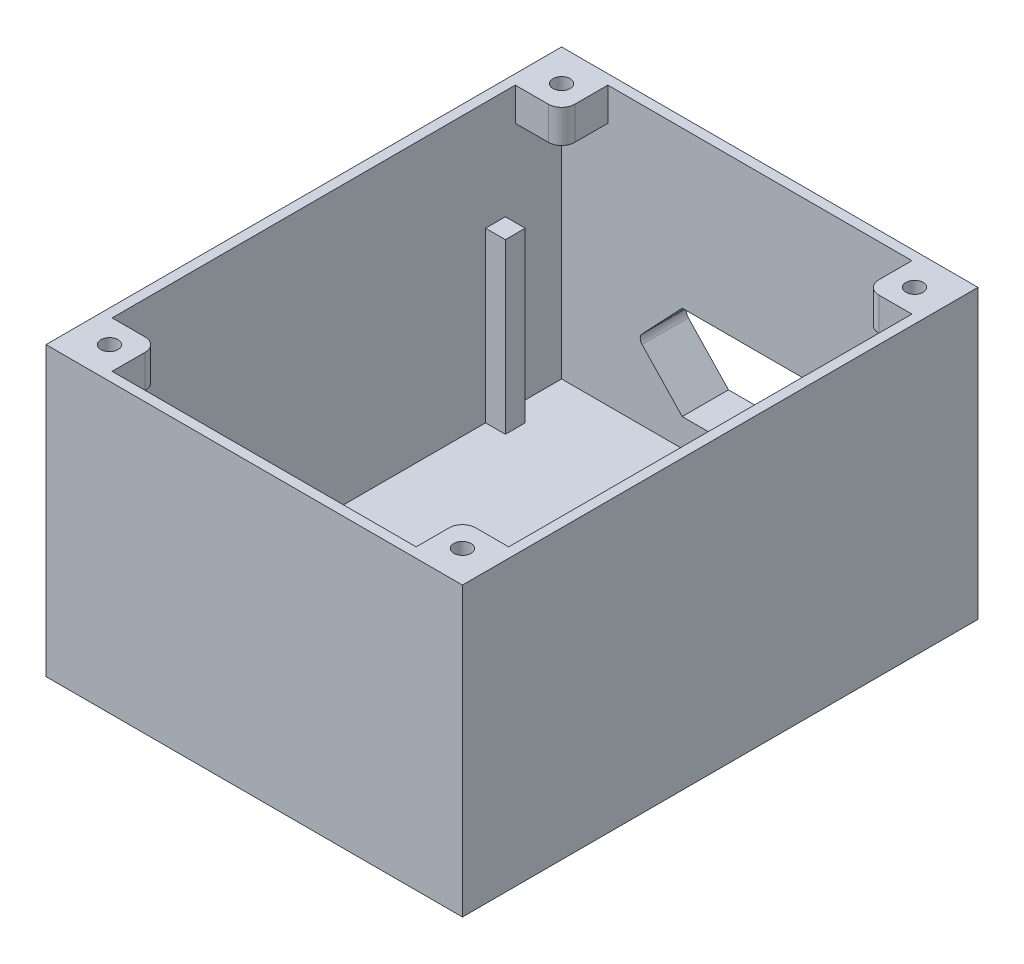
from build123d import *

# Parameters (mm, degrees)
ESBO_O1_W                 = 63
ESBO_O1_H                 = 45
ESBO_O1_W_2               = 60
ESBO_O1_H_2               = 42
RESSALTO_EXTRUS_O2_DEPTH  = 1.5
RESSALTO_EXTRUS_O3_START  = 1.5
ESBO_O1_3_W               = 63
ESBO_O1_3_H               = 45
ESBO_O1_3_W_2             = 60
ESBO_O1_3_H_2             = 42
RESSALTO_EXTRUS_O3_DEPTH  = 75
RESSALTO_EXTRUS_O4_DEPTH  = 15
CORTE_EXTRUS_O1_DEPTH     = 27
ESBO_O4_W                 = 63
ESBO_O4_H                 = 45
RESSALTO_EXTRUS_O6_DEPTH  = 1.5
ESBO_O5_W                 = 63
ESBO_O5_H                 = 1.5
CORTE_EXTRUS_O2_DEPTH     = 109.436617432
RESSALTO_EXTRUS_O7_START  = 42
ESBO_O6_R                 = 1.3
RESSALTO_EXTRUS_O7_DEPTH  = 5
ESPELHAR2_START           = 42
ESPELHAR2_COPY_1_SKETCH_R = 1.3
ESPELHAR2_COPY_1_DEPTH    = 5
RESSALTO_EXTRUS_O8_START  = -5.5
RESSALTO_EXTRUS_O8_DEPTH  = 5.5
ESBO_O7_W                 = 3
ESBO_O7_H                 = 3
RESSALTO_EXTRUS_O9_DEPTH  = 25.5


with BuildPart() as part:
    # Esboço1 → Ressalto-extrusão2 (new body)
    # profile 1 of 3: a face of its own
    with BuildSketch(Plane.XY):
        with Locations((30, 21)):
            Rectangle(ESBO_O1_W, ESBO_O1_H)
        with Locations((30, 21)):
            Rectangle(ESBO_O1_W_2, ESBO_O1_H_2, mode=Mode.SUBTRACT)
    # profile 2 of 3: a face of its own
    with BuildSketch(Plane.XY):
        with Locations((30, 21)):
            Rectangle(ESBO_O1_W_2, ESBO_O1_H_2)
        with BuildLine():
            ThreePointArc((12.174114264, 11.987815308), (11.9, 11.3), (12.174114264, 10.612184692))
            Line((12.174114264, 10.612184692), (18.25, 4.2))
            Line((18.25, 4.2), (41.75, 4.2))
            Line((41.75, 4.2), (47.825885736, 10.612184692))
            ThreePointArc((47.825885736, 10.612184692), (48.1, 11.3), (47.825885736, 11.987815308))
            Line((47.825885736, 11.987815308), (41.75, 18.4))
            Line((41.75, 18.4), (18.25, 18.4))
            Line((18.25, 18.4), (12.174114264, 11.987815308))
        make_face(mode=Mode.SUBTRACT)
    # profile 3 of 3: a face of its own
    with BuildSketch(Plane.XY):
        with Locations((30, 21)):
            Rectangle(ESBO_O1_W_2, ESBO_O1_H_2)
        with BuildLine():
            ThreePointArc((10.722342792, 13.363445925), (9.9, 11.3), (10.722342792, 9.236554075))
            Line((10.722342792, 9.236554075), (17.389851698, 2.2))
            Line((17.389851698, 2.2), (42.610148302, 2.2))
            Line((42.610148302, 2.2), (49.277657208, 9.236554075))
            ThreePointArc((49.277657208, 9.236554075), (50.1, 11.3), (49.277657208, 13.363445925))
            Line((49.277657208, 13.363445925), (42.610148302, 20.4))
            Line((42.610148302, 20.4), (17.389851698, 20.4))
            Line((17.389851698, 20.4), (10.722342792, 13.363445925))
        make_face(mode=Mode.SUBTRACT)
    extrude(amount=RESSALTO_EXTRUS_O2_DEPTH)

    # Esboço1<3> → Ressalto-extrusão3 (add)
    with BuildSketch(Plane.XY.offset(RESSALTO_EXTRUS_O3_START)):
        with Locations((30, 21)):
            Rectangle(ESBO_O1_3_W, ESBO_O1_3_H)
        with Locations((30, 21)):
            Rectangle(ESBO_O1_3_W_2, ESBO_O1_3_H_2, mode=Mode.SUBTRACT)
    extrude(amount=RESSALTO_EXTRUS_O3_DEPTH)

    # Esboço2 → Ressalto-extrusão4 (add)
    with BuildSketch(Plane(origin=(0, 0, 0), x_dir=(1, 0, 0), z_dir=(0, 1, 0))):
        with BuildLine():
            Line((18.25, -54.8), (41.75, -54.8))
            Line((41.75, -54.8), (48.66440786, -62.248218844))
            ThreePointArc((48.66440786, -62.248218844), (49.654140055, -63.822712297), (50, -65.65))
            Line((50, -65.65), (51.5, -65.65))
            ThreePointArc((51.5, -65.65), (51.050382071, -63.274525986), (49.763730218, -61.227684497))
            Line((49.763730218, -61.227684497), (42.404219824, -53.3))
            Line((42.404219824, -53.3), (17.595780176, -53.3))
            Line((17.595780176, -53.3), (10.236269782, -61.227684497))
            ThreePointArc((10.236269782, -61.227684497), (8.949617929, -63.274525986), (8.5, -65.65))
            Line((8.5, -65.65), (10, -65.65))
            ThreePointArc((10, -65.65), (10.345859945, -63.822712297), (11.33559214, -62.248218844))
            Line((11.33559214, -62.248218844), (18.25, -54.8))
        make_face()
        with BuildLine():
            ThreePointArc((11.33559214, -69.051781156), (10.345859945, -67.477287703), (10, -65.65))
            Line((10, -65.65), (8.5, -65.65))
            ThreePointArc((8.5, -65.65), (8.949617929, -68.025474014), (10.236269782, -70.072315503))
            Line((10.236269782, -70.072315503), (16.2032846, -76.5))
            Line((16.2032846, -76.5), (18.25, -76.5))
            Line((18.25, -76.5), (11.33559214, -69.051781156))
        make_face()
        with BuildLine():
            Line((51.5, -65.65), (50, -65.65))
            ThreePointArc((50, -65.65), (49.654140055, -67.477287703), (48.66440786, -69.051781156))
            Line((48.66440786, -69.051781156), (41.75, -76.5))
            Line((41.75, -76.5), (43.7967154, -76.5))
            Line((43.7967154, -76.5), (49.763730218, -70.072315503))
            ThreePointArc((49.763730218, -70.072315503), (51.050382071, -68.025474014), (51.5, -65.65))
        make_face()
    extrude(amount=RESSALTO_EXTRUS_O4_DEPTH)

    # Esboço2<3> → Corte-extrusão1 (cut)
    with BuildSketch(Plane(origin=(0, 0, 0), x_dir=(1, 0, 0), z_dir=(0, 1, 0))):
        with BuildLine():
            Line((41.095780176, -56.3), (30, -56.3))
            Line((30, -56.3), (30, -75))
            Line((30, -75), (41.095780176, -75))
            Line((41.095780176, -75), (47.565085502, -68.031246809))
            ThreePointArc((47.565085502, -68.031246809), (48.5, -65.65), (47.565085502, -63.268753191))
            Line((47.565085502, -63.268753191), (41.095780176, -56.3))
        make_face()
        with BuildLine():
            Line((30, -75), (30, -56.3))
            Line((30, -56.3), (18.904219824, -56.3))
            Line((18.904219824, -56.3), (12.434914498, -63.268753191))
            ThreePointArc((12.434914498, -63.268753191), (11.5, -65.65), (12.434914498, -68.031246809))
            Line((12.434914498, -68.031246809), (18.904219824, -75))
            Line((18.904219824, -75), (30, -75))
        make_face()
    extrude(amount=-CORTE_EXTRUS_O1_DEPTH, mode=Mode.SUBTRACT)

    # Esboço4 → Ressalto-extrusão6 (add)
    with BuildSketch(Plane.XY.offset(76.5)):
        with Locations((30, 21)):
            Rectangle(ESBO_O4_W, ESBO_O4_H)
    extrude(amount=RESSALTO_EXTRUS_O6_DEPTH)

    # Esboço5 → Corte-extrusão2 (cut, through all)
    with BuildSketch(Plane.XY.offset(78)):
        with Locations((30, 42.75)):
            Rectangle(ESBO_O5_W, ESBO_O5_H)
    extrude(amount=-CORTE_EXTRUS_O2_DEPTH, mode=Mode.SUBTRACT)

    # Esboço6 → Ressalto-extrusão7 (add)
    with BuildSketch(Plane(origin=(0, 0, 0), x_dir=(1, 0, 0), z_dir=(0, 1, 0)).offset(RESSALTO_EXTRUS_O7_START)):
        with BuildLine():
            Line((60, -1.5), (60, -8.5))
            Line((60, -8.5), (55, -8.5))
            ThreePointArc((55, -8.5), (53.585786438, -7.914213562), (53, -6.5))
            Line((53, -6.5), (53, -1.5))
            Line((53, -1.5), (60, -1.5))
        make_face()
        with Locations(Location((56.7, -4.8, 0), (0, 0, 90))):
            Circle(ESBO_O6_R, mode=Mode.SUBTRACT)
    ressalto_extrus_o7 = extrude(amount=-RESSALTO_EXTRUS_O7_DEPTH)

    # Espelhar1: Ressalto-extrusão7 across plane
    add(ressalto_extrus_o7.mirror(Plane.XY.offset(39)))

    # Espelhar2: Ressalto-extrusão7 across plane
    add(ressalto_extrus_o7.mirror(Plane.ZY.offset(-30)))

    # Espelhar2 copy 1 sketch → Espelhar2 copy 1 (add)
    with BuildSketch(Plane(origin=(60, 0, 78), x_dir=(-1, 0, 0), z_dir=(0, 1, 0)).offset(ESPELHAR2_START)):
        with BuildLine():
            Line((60, -1.5), (60, -8.5))
            Line((60, -8.5), (55, -8.5))
            ThreePointArc((55, -8.5), (53.585786438, -7.914213562), (53, -6.5))
            Line((53, -6.5), (53, -1.5))
            Line((53, -1.5), (60, -1.5))
        make_face()
        with Locations(Location((56.7, -4.8, 0), (0, 0, 90))):
            Circle(ESPELHAR2_COPY_1_SKETCH_R, mode=Mode.SUBTRACT)
    extrude(amount=-ESPELHAR2_COPY_1_DEPTH)

    # Esboço1<4> → Ressalto-extrusão8 (add)
    with BuildSketch(Plane.XY.offset(RESSALTO_EXTRUS_O8_START)):
        with BuildLine():
            Line((17.389851698, 20.4), (10.722342792, 13.363445925))
            ThreePointArc((10.722342792, 13.363445925), (9.9, 11.3), (10.722342792, 9.236554075))
            Line((10.722342792, 9.236554075), (17.389851698, 2.2))
            Line((17.389851698, 2.2), (42.610148302, 2.2))
            Line((42.610148302, 2.2), (49.277657208, 9.236554075))
            ThreePointArc((49.277657208, 9.236554075), (50.1, 11.3), (49.277657208, 13.363445925))
            Line((49.277657208, 13.363445925), (42.610148302, 20.4))
            Line((42.610148302, 20.4), (17.389851698, 20.4))
        make_face()
        with BuildLine():
            ThreePointArc((12.174114264, 11.987815308), (11.9, 11.3), (12.174114264, 10.612184692))
            Line((12.174114264, 10.612184692), (18.25, 4.2))
            Line((18.25, 4.2), (41.75, 4.2))
            Line((41.75, 4.2), (47.825885736, 10.612184692))
            ThreePointArc((47.825885736, 10.612184692), (48.1, 11.3), (47.825885736, 11.987815308))
            Line((47.825885736, 11.987815308), (41.75, 18.4))
            Line((41.75, 18.4), (18.25, 18.4))
            Line((18.25, 18.4), (12.174114264, 11.987815308))
        make_face(mode=Mode.SUBTRACT)
    extrude(amount=RESSALTO_EXTRUS_O8_DEPTH)

    # Esboço7 → Ressalto-extrusão9 (add)
    with BuildSketch(Plane(origin=(0, 0, 0), x_dir=(1, 0, 0), z_dir=(0, 1, 0))):
        with Locations((58.5, -11.5)):
            Rectangle(ESBO_O7_W, ESBO_O7_H)
    ressalto_extrus_o9 = extrude(amount=RESSALTO_EXTRUS_O9_DEPTH)

    # Espelhar3: Ressalto-extrusão9 across plane
    add(ressalto_extrus_o9.mirror(Plane.ZY.offset(-30)))


solid = part.part
